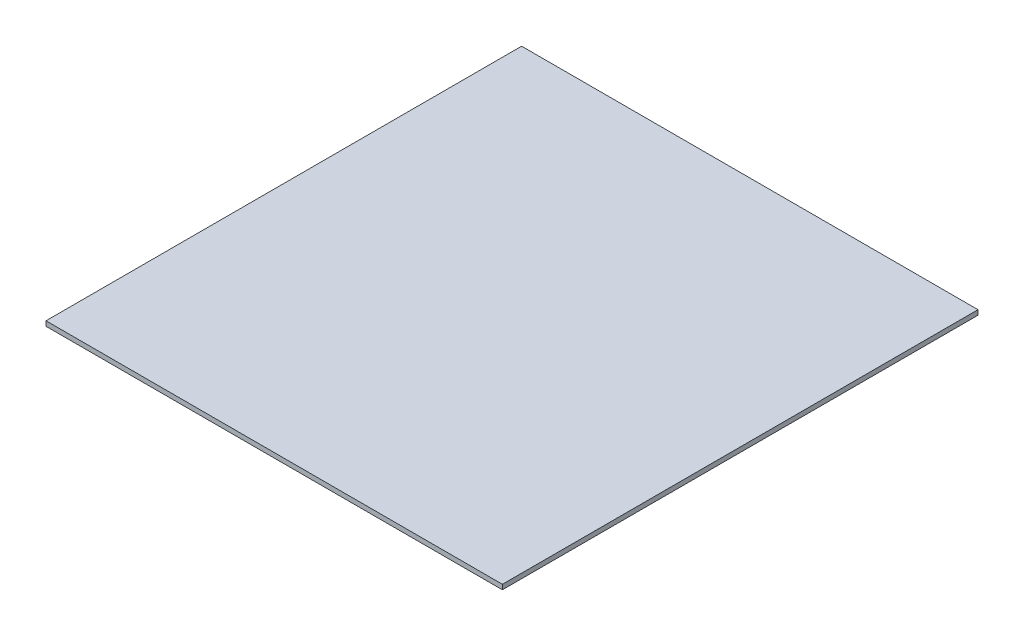
from build123d import *

# Parameters (mm, degrees)
SKETCH1_W           = 190
SKETCH1_H           = 198
BOSS_EXTRUDE1_DEPTH = 1


with BuildPart() as part:
    # Sketch1 → Boss-Extrude1 (new, symmetric)
    with BuildSketch(Plane(origin=(0, 0, 0), x_dir=(1, 0, 0), z_dir=(0, 1, 0))):
        Rectangle(SKETCH1_W, SKETCH1_H)
    extrude(amount=BOSS_EXTRUDE1_DEPTH, both=True)


solid = part.part
